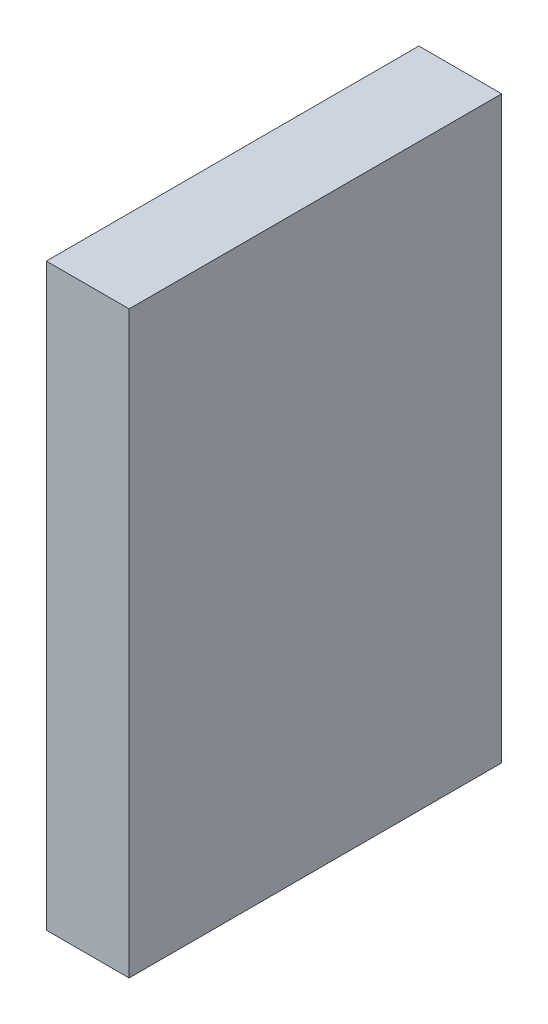
from build123d import *

# Parameters (mm, degrees)
SKETCH1_W           = 45
SKETCH1_H           = 70
BOSS_EXTRUDE1_DEPTH = 10


with BuildPart() as part:
    # Sketch1 → Boss-Extrude1 (new body)
    with BuildSketch(Plane(origin=(0, 0, 0), x_dir=(0, 0, -1), z_dir=(1, 0, 0))):
        Rectangle(SKETCH1_W, SKETCH1_H)
    extrude(amount=BOSS_EXTRUDE1_DEPTH)


solid = part.part
